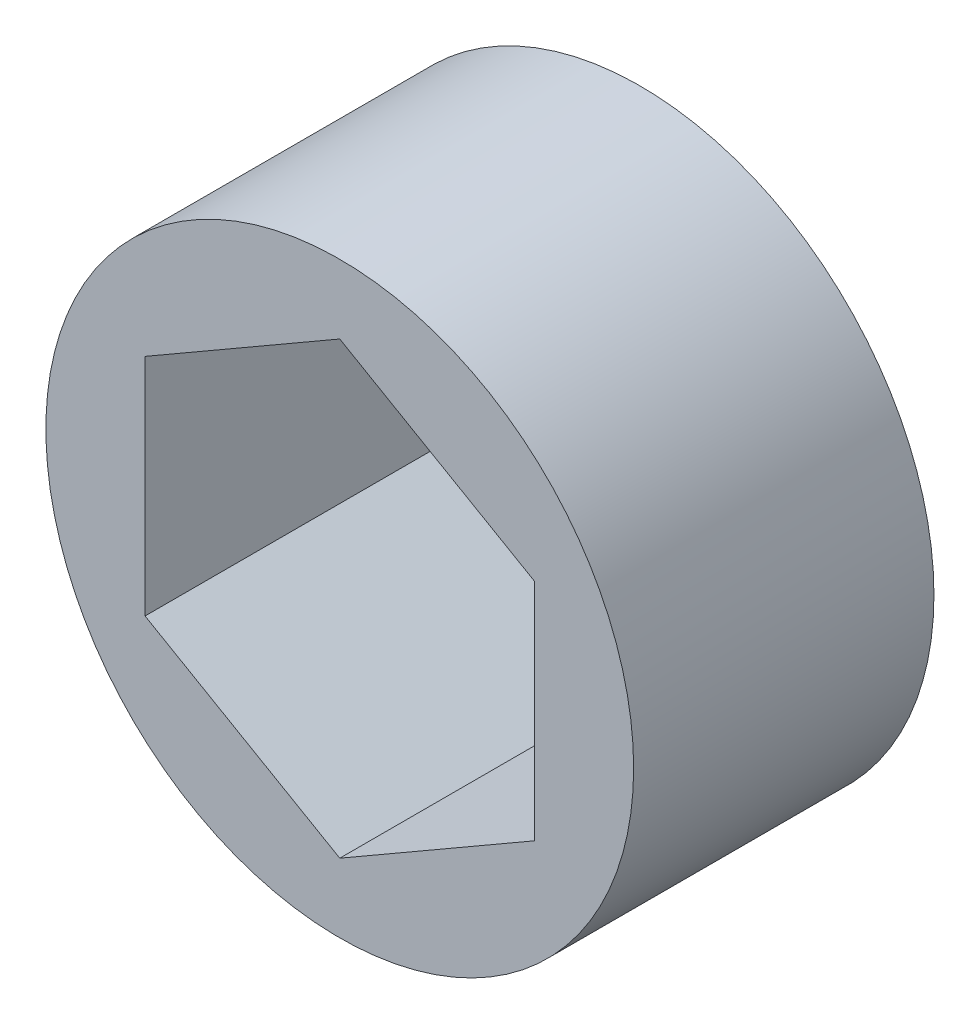
from build123d import *

# Parameters (mm, degrees)
SKETCH1_R           = 10.16
BOSS_EXTRUDE1_DEPTH = 10.381500192


with BuildPart() as part:
    # Sketch1 → Boss-Extrude1 (new body)
    with BuildSketch(Plane.XY):
        Circle(SKETCH1_R)
        Polygon((6.731, 3.886144662), (0, 7.772289324), (-6.731, 3.886144662), (-6.731, -3.886144662), (0, -7.772289324), (6.731, -3.886144662), align=None, mode=Mode.SUBTRACT)
    extrude(amount=BOSS_EXTRUDE1_DEPTH)


solid = part.part
